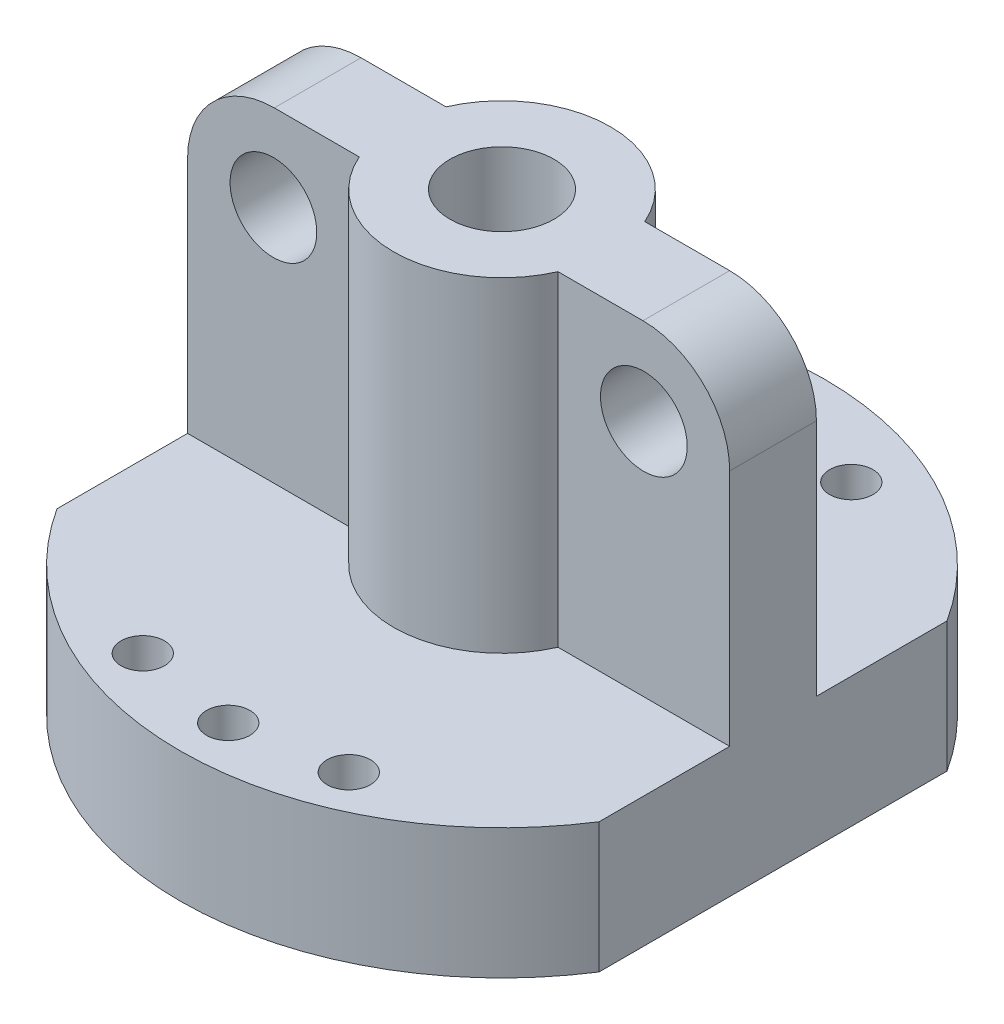
from build123d import *

# Parameters (mm, degrees)
SKETCH1_R            = 29.705
BASE_DEPTH           = 12
SUPPORT_SHAPE_DEPTH  = 30
SKETCH3_R            = 4.8
PEN_HOLE_DEPTH       = 86.315453863
SKETCH5_R            = 2
BOLT_HOLES_DEPTH     = 86.315453863
ELASTIC_HOLES_REACH  = 68.458
SKETCH8_R            = 4
DECORATIVE_FILLET_R  = 8
SKETCH9_W            = 13.029443146
SKETCH9_H            = 56.051778338
SKETCH9_W_2          = 11.207609874
SKETCH9_H_2          = 62.108426406
DECORATIVE_CUT_DEPTH = 81.091988787


with BuildPart() as part:
    # Sketch1 → Base (new body)
    with BuildSketch(Plane(origin=(0, 6, 0), x_dir=(1, 0, 0), z_dir=(0, 1, 0))):
        with Locations(Location((1.546657586, 37.660128709, 0), (0, 0, 270))):
            Circle(SKETCH1_R)
    extrude(amount=BASE_DEPTH)

    # Sketch2 → Support Shape (add)
    with BuildSketch(Plane(origin=(0, 18, 0), x_dir=(1, 0, 0), z_dir=(0, 1, 0))):
        with BuildLine():
            Line((-7.618493804, 41.660128709), (-23.453342414, 41.660128709))
            Line((-23.453342414, 41.660128709), (-23.453342414, 33.660128709))
            Line((-23.453342414, 33.660128709), (-7.618493804, 33.660128709))
            ThreePointArc((-7.618493804, 33.660128709), (-8.453342414, 37.660128709), (-7.618493804, 41.660128709))
        make_face()
        with BuildLine():
            ThreePointArc((10.711808976, 41.660128709), (1.546657586, 47.660128709), (-7.618493804, 41.660128709))
            Line((-7.618493804, 41.660128709), (10.711808976, 41.660128709))
        make_face()
        with BuildLine():
            Line((10.711808976, 41.660128709), (-7.618493804, 41.660128709))
            ThreePointArc((-7.618493804, 41.660128709), (-8.453342414, 37.660128709), (-7.618493804, 33.660128709))
            Line((-7.618493804, 33.660128709), (10.711808976, 33.660128709))
            ThreePointArc((10.711808976, 33.660128709), (11.335720716, 35.617032272), (11.546657586, 37.660128709))
            ThreePointArc((11.546657586, 37.660128709), (11.335720716, 39.703225146), (10.711808976, 41.660128709))
        make_face()
        with BuildLine():
            Line((10.711808976, 33.660128709), (-7.618493804, 33.660128709))
            ThreePointArc((-7.618493804, 33.660128709), (1.546657586, 27.660128709), (10.711808976, 33.660128709))
        make_face()
        with BuildLine():
            Line((26.546657586, 41.660128709), (10.711808976, 41.660128709))
            ThreePointArc((10.711808976, 41.660128709), (11.335720716, 39.703225146), (11.546657586, 37.660128709))
            ThreePointArc((11.546657586, 37.660128709), (11.335720716, 35.617032272), (10.711808976, 33.660128709))
            Line((10.711808976, 33.660128709), (26.546657586, 33.660128709))
            Line((26.546657586, 33.660128709), (26.546657586, 41.660128709))
        make_face()
    extrude(amount=SUPPORT_SHAPE_DEPTH)

    # Sketch3 → Pen Hole (cut, through all)
    with BuildSketch(Plane(origin=(0, 48, 0), x_dir=(1, 0, 0), z_dir=(0, 1, 0))):
        with Locations(Location((1.546657586, 37.660128709, 0), (0, 0, 270))):
            Circle(SKETCH3_R)
    extrude(amount=-PEN_HOLE_DEPTH, mode=Mode.SUBTRACT)

    # Sketch5 → Bolt Holes (cut, through all)
    with BuildSketch(Plane.XZ.offset(-6)):
        with Locations(Location((-7.953342414, -14.026565813, 0), (0, 0, 270))):
            Circle(SKETCH5_R)
        with Locations(Location((1.546657586, -12.410128709, 0), (0, 0, 270))):
            Circle(SKETCH5_R)
        with Locations(Location((11.046657586, -14.026565813, 0), (0, 0, 270))):
            Circle(SKETCH5_R)
        with Locations(Location((11.046657586, -60.376565813, 0), (0, 0, 270))):
            Circle(SKETCH5_R)
        with Locations(Location((1.546657586, -62.910128709, 0), (0, 0, 270))):
            Circle(SKETCH5_R)
        with Locations(Location((-7.953342414, -60.376565813, 0), (0, 0, 270))):
            Circle(SKETCH5_R)
    extrude(amount=-BOLT_HOLES_DEPTH, mode=Mode.SUBTRACT)

    # Sketch8 → Elastic Holes (cut, up to next)
    with BuildSketch(Plane.XY.offset(-33.660128709), mode=Mode.PRIVATE) as elastic_holes_sk1:
        with Locations((18.629233281, 40)):
            Circle(SKETCH8_R)
    elastic_holes_tool1 = extrude(elastic_holes_sk1.sketch, amount=-ELASTIC_HOLES_REACH, mode=Mode.PRIVATE) & part.part
    # Sketch8 → Elastic Holes (cut, up to next)
    with BuildSketch(Plane.XY.offset(-33.660128709), mode=Mode.PRIVATE) as elastic_holes_sk2:
        with Locations(Location((-15.535918109, 40, 0), (0, 0, 180))):
            Circle(SKETCH8_R)
    elastic_holes_tool2 = extrude(elastic_holes_sk2.sketch, amount=-ELASTIC_HOLES_REACH, mode=Mode.PRIVATE) & part.part
    add(elastic_holes_tool1.solids().sort_by_distance((18.629233, 40, -33.660129))[0], mode=Mode.SUBTRACT)
    add(elastic_holes_tool2.solids().sort_by_distance((-15.535918, 40, -33.660129))[0], mode=Mode.SUBTRACT)

    # Decorative Fillet
    decorative_fillet_edges = [part.edges().sort_by_distance(p)[0] for p in [
        (26.546657586, 48, -37.660128709),
        (-23.453342414, 48, -37.660128709),
    ]]
    fillet(decorative_fillet_edges, radius=DECORATIVE_FILLET_R)

    # Sketch9 → Decorative Cut (cut, through all)
    with BuildSketch(Plane(origin=(0, 18, 0), x_dir=(1, 0, 0), z_dir=(0, 1, 0))):
        with Locations((33.061379159, 37.205930485)):
            Rectangle(SKETCH9_W, SKETCH9_H)
        with Locations((-29.057147351, 40.234254519)):
            Rectangle(SKETCH9_W_2, SKETCH9_H_2)
    extrude(amount=-DECORATIVE_CUT_DEPTH, mode=Mode.SUBTRACT)


solid = part.part
